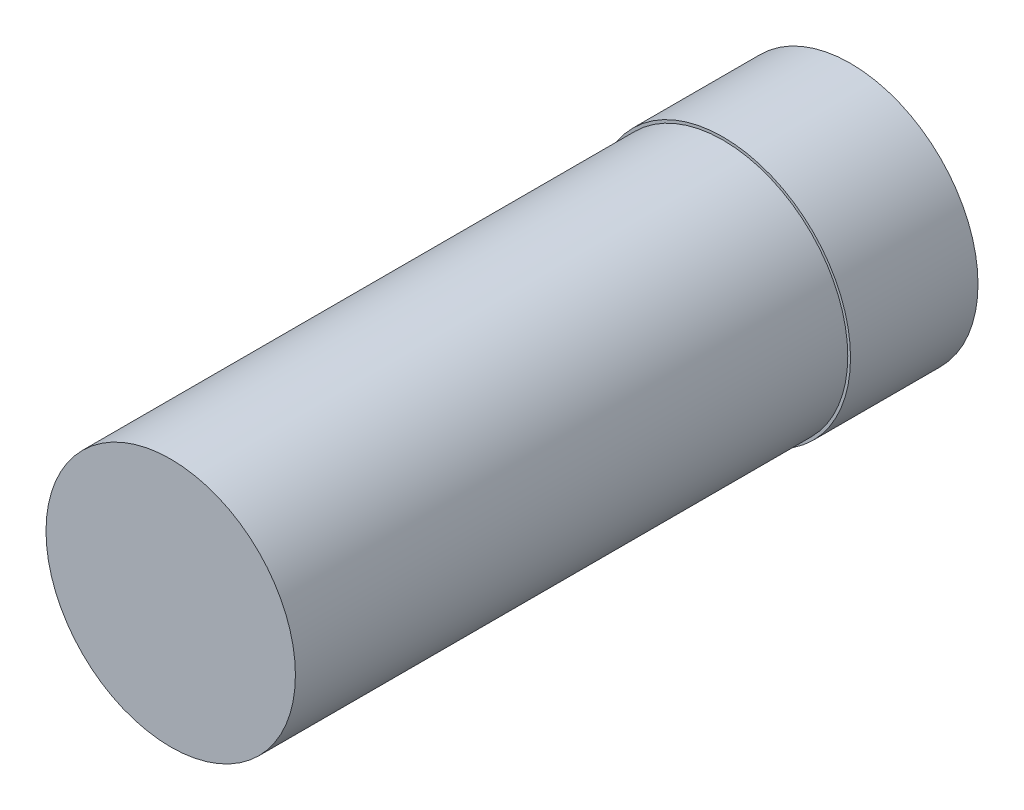
from build123d import *

# Parameters (mm, degrees)
SKETCH_1_R      = 3
EXTRUDE_1_DEPTH = 3
SKETCH_2_R      = 2.935
EXTRUDE_2_DEPTH = 13


with BuildPart() as part:
    # 스케치1 → 보스-돌출1 (new body)
    with BuildSketch(Plane.XY):
        Circle(SKETCH_1_R)
    extrude(amount=EXTRUDE_1_DEPTH)

    # 스케치2 → 보스-돌출2 (add)
    with BuildSketch(Plane.XY.offset(3)):
        with Locations(Location((0, 0, 0), (0, 0, 180))):
            Circle(SKETCH_2_R)
    extrude(amount=EXTRUDE_2_DEPTH)


solid = part.part
